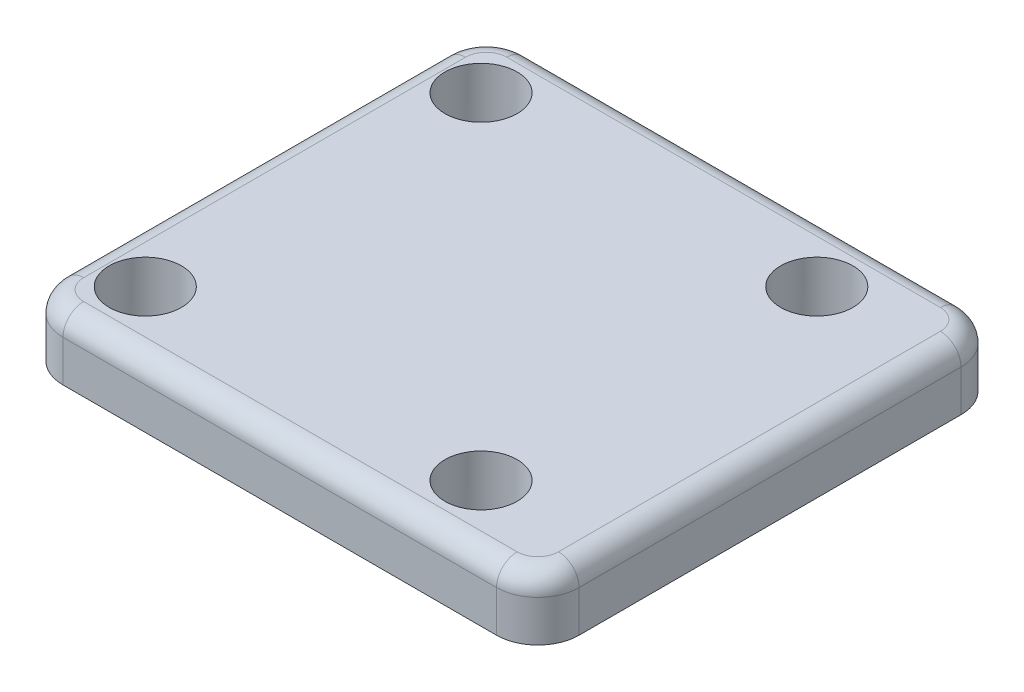
from build123d import *

# Parameters (mm, degrees)
BOSS_EXTRUDE1_DEPTH = 6
FILLET1_R           = 2
SKETCH2_R           = 16
BOSS_EXTRUDE2_DEPTH = 2
CHAMFER1_SIZE       = 1
SKETCH3_R           = 3.5
CUT_EXTRUDE1_DEPTH  = 37.800135869


with BuildPart() as part:
    # Sketch1 → Boss-Extrude1 (new body)
    with BuildSketch(Plane(origin=(0, 0, 0), x_dir=(1, 0, 0), z_dir=(0, 1, 0))):
        with BuildLine():
            Line((-18, 22.5), (24, 22.5))
            ThreePointArc((24, 22.5), (26.828427125, 21.328427125), (28, 18.5))
            Line((28, 18.5), (28, -18.5))
            ThreePointArc((28, -18.5), (26.828427125, -21.328427125), (24, -22.5))
            Line((24, -22.5), (-18, -22.5))
            ThreePointArc((-18, -22.5), (-20.828427125, -21.328427125), (-22, -18.5))
            Line((-22, -18.5), (-22, 18.5))
            ThreePointArc((-22, 18.5), (-20.828427125, 21.328427125), (-18, 22.5))
        make_face()
    extrude(amount=BOSS_EXTRUDE1_DEPTH)

    # Fillet1
    fillet1_edges = [part.edges().sort_by_distance(p)[0] for p in [
        (-20.828427125, 6, -21.328427125),
        (-22, 6, 0),
        (-20.828427125, 6, 21.328427125),
        (3, 6, 22.5),
        (26.828427125, 6, 21.328427125),
        (28, 6, 0),
        (26.828427125, 6, -21.328427125),
        (3, 6, -22.5),
    ]]
    fillet(fillet1_edges, radius=FILLET1_R)

    # Sketch2 → Boss-Extrude2 (add)
    with BuildSketch(Plane.XZ):
        with Locations(Location((0, 0, 0), (0, 0, 270))):
            Circle(SKETCH2_R)
    extrude(amount=BOSS_EXTRUDE2_DEPTH)

    # Chamfer1
    chamfer1_edges = [part.edges().sort_by_distance(p)[0] for p in [
        (0, -2, 16),
    ]]
    chamfer(chamfer1_edges, length=CHAMFER1_SIZE)

    # Sketch3 → Cut-Extrude1 (cut, through all)
    with BuildSketch(Plane(origin=(0, 6, 0), x_dir=(1, 0, 0), z_dir=(0, 1, 0))):
        with Locations(Location((-16.263455967, 16.263455967, 0), (0, 0, 270))):
            Circle(SKETCH3_R)
        with Locations(Location((16.263455967, 16.263455967, 0), (0, 0, 270))):
            Circle(SKETCH3_R)
        with Locations(Location((16.263455967, -16.263455967, 0), (0, 0, 270))):
            Circle(SKETCH3_R)
        with Locations(Location((-16.263455967, -16.263455967, 0), (0, 0, 270))):
            Circle(SKETCH3_R)
    extrude(amount=-CUT_EXTRUDE1_DEPTH, mode=Mode.SUBTRACT)


solid = part.part
